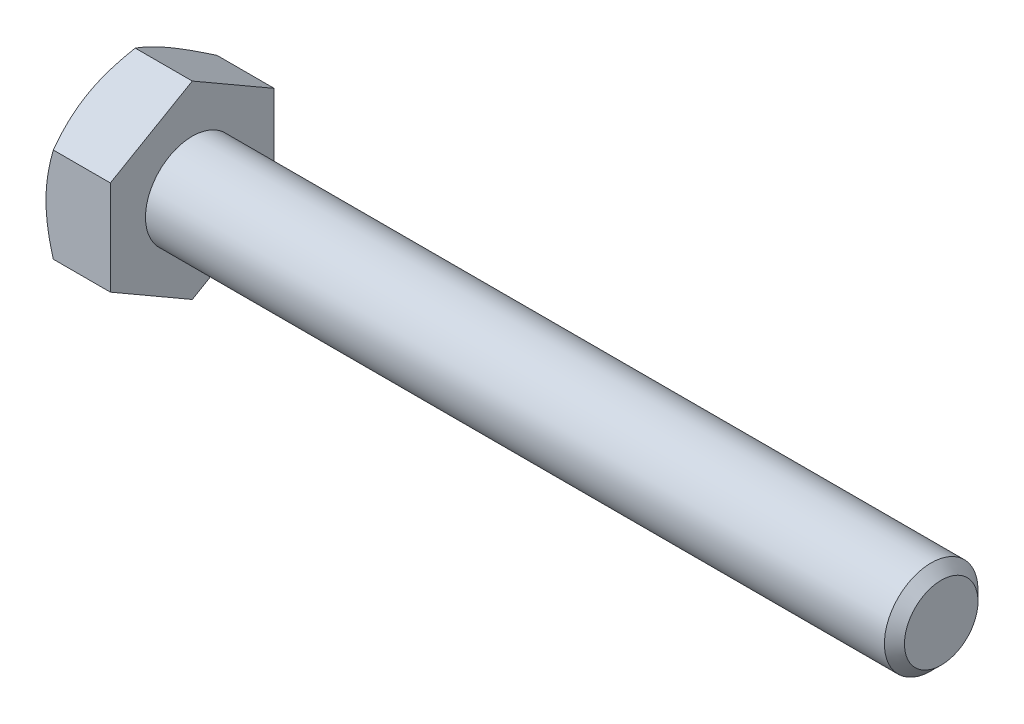
from build123d import *

# Parameters (mm, degrees)
SKETCH5_R           = 3.175
BOSS_EXTRUDE3_DEPTH = 50.8
CHAMFER1_SIZE       = 0.680357143
BOSS_EXTRUDE4_DEPTH = 4.365625
SKETCH8_OUTSIDE_W   = 221.468
SKETCH8_OUTSIDE_H   = 223.188
SKETCH8_OUTSIDE_R   = 5.55625
CUT_EXTRUDE3_DEPTH  = 56.814699209
CUT_EXTRUDE3_DRAFT  = -60


with BuildPart() as part:
    # Sketch5 → Boss-Extrude3 (new body)
    with BuildSketch(Plane(origin=(27.5828125, 0, 0), x_dir=(0, 0, -1), z_dir=(1, 0, 0))):
        Circle(SKETCH5_R)
    extrude(amount=-BOSS_EXTRUDE3_DEPTH)

    # Chamfer1
    chamfer1_edges = [part.edges().sort_by_distance(p)[0] for p in [
        (27.5828125, 0, 3.175),
    ]]
    chamfer(chamfer1_edges, length=CHAMFER1_SIZE)

    # Sketch6 → Boss-Extrude4 (add)
    with BuildSketch(Plane.ZY.offset(23.2171875)):
        Polygon((5.55625, 3.207902433), (0, 6.415804866), (-5.55625, 3.207902433), (-5.55625, -3.207902433), (0, -6.415804866), (5.55625, -3.207902433), align=None)
    extrude(amount=BOSS_EXTRUDE4_DEPTH)


with BuildPart() as cut_extrude3_tool:
    # Sketch8 outside → Cut-Extrude3 (with draft: the straight prism first)
    with BuildSketch(Plane.ZY.offset(27.5828125)):
        Rectangle(SKETCH8_OUTSIDE_W, SKETCH8_OUTSIDE_H)
        Circle(SKETCH8_OUTSIDE_R, mode=Mode.SUBTRACT)
    extrude(amount=-CUT_EXTRUDE3_DEPTH)
    # Cut-Extrude3: the draft: its side faces are tilted about the plane it starts from
    cut_extrude3_sides = [cut_extrude3_tool.faces().sort_by_distance(p)[0] for p in [
        (0.824537104, -111.594, 0),
        (0.824537104, 0, 110.734),
        (0.824537104, 111.594, 0),
        (0.824537104, 0, -110.734),
        (0.824537104, 0, -5.55625),
    ]]
    draft(cut_extrude3_sides, Plane.ZY.offset(27.5828125), CUT_EXTRUDE3_DRAFT)


with BuildPart() as part_1:
    add(part.part)

    # Cut-Extrude3: cut by cut_extrude3_tool
    add(cut_extrude3_tool.part, mode=Mode.SUBTRACT)


solid = part_1.part
